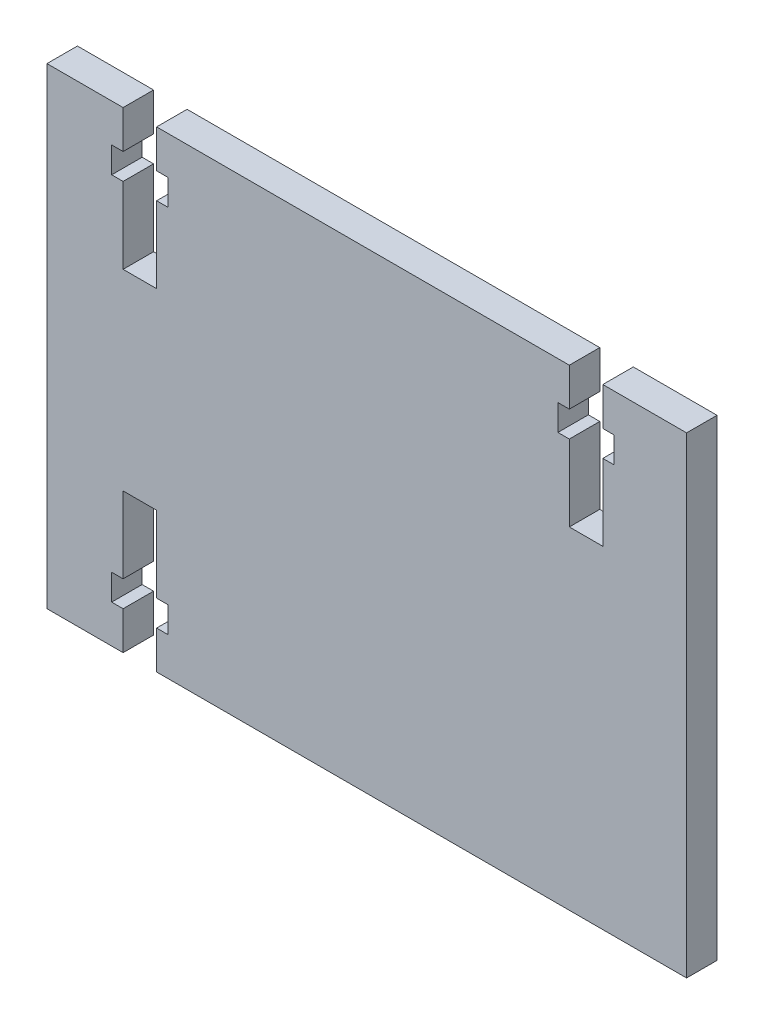
from build123d import *

# Parameters (mm, degrees)
SKETCH1_W           = 84
SKETCH1_H           = 62
BOSS_EXTRUDE1_DEPTH = 4
CUT_EXTRUDE2_DEPTH  = 5


with BuildPart() as part:
    # Sketch1 → Boss-Extrude1 (new body)
    with BuildSketch(Plane.XY):
        with Locations((0.5, 0)):
            Rectangle(SKETCH1_W, SKETCH1_H)
    extrude(amount=BOSS_EXTRUDE1_DEPTH)

    # Sketch3 → Cut-Extrude2 (cut)
    with BuildSketch(Plane.XY.offset(4)):
        Polygon((-27.1, 22.6), (-27.1, 12.6), (-31.5, 12.6), (-31.5, 22.6), (-33, 22.6), (-33, 26), (-31.5, 26), (-31.5, 31), (-27.1, 31), (-27.1, 26), (-25.6, 26), (-25.6, 22.6), align=None)
        Polygon((31.5, 12.6), (31.5, 22.6), (33, 22.6), (33, 26), (31.5, 26), (31.5, 31), (27.1, 31), (27.1, 26), (25.6, 26), (25.6, 22.6), (27.1, 22.6), (27.1, 12.6), align=None)
        Polygon((-31.5, -12.6), (-31.5, -22.6), (-33, -22.6), (-33, -26), (-31.5, -26), (-31.5, -31), (-27.1, -31), (-27.1, -26), (-25.6, -26), (-25.6, -22.6), (-27.1, -22.6), (-27.1, -12.6), align=None)
    extrude(amount=-CUT_EXTRUDE2_DEPTH, mode=Mode.SUBTRACT)


solid = part.part
